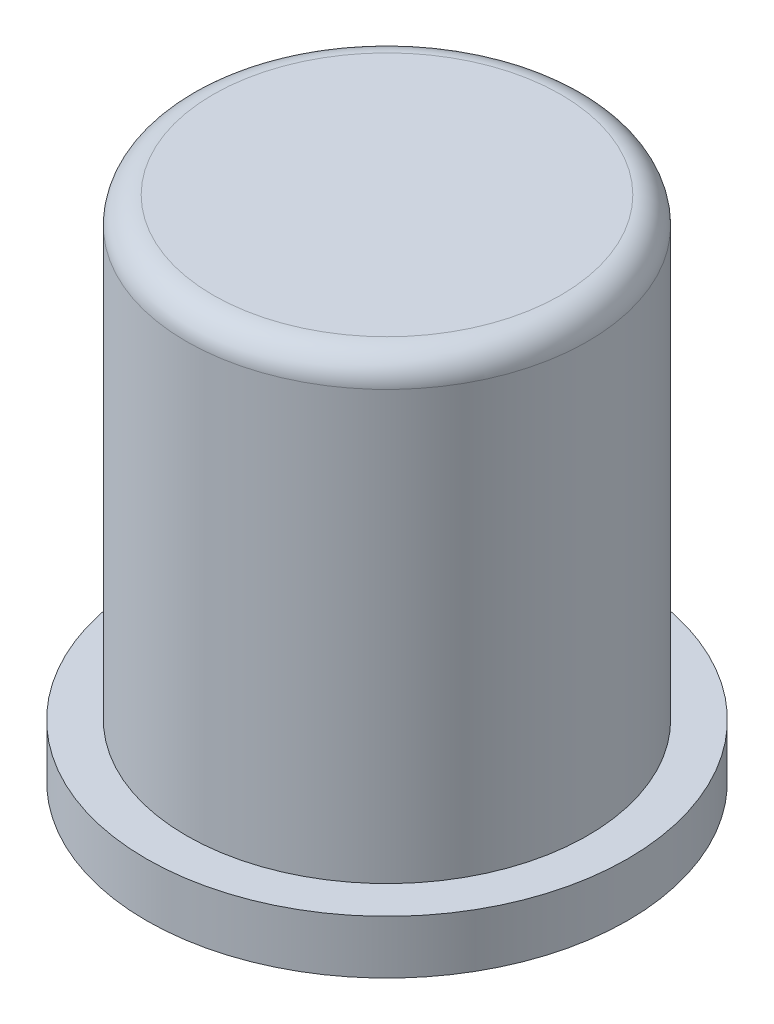
from build123d import *

# Parameters (mm, degrees)
CROQUIS1_R              = 4.5
SALIENTE_EXTRUIR1_DEPTH = 9.5
CORTAR_EXTRUIR1_START   = -8.5
CROQUIS2_R              = 4.5
CROQUIS2_R_2            = 3.75
CORTAR_EXTRUIR1_DEPTH   = 8.5
REDONDEO1_R             = 0.5


with BuildPart() as part:
    # Croquis1 → Saliente-Extruir1 (new body)
    with BuildSketch(Plane(origin=(0, 0, 0), x_dir=(1, 0, 0), z_dir=(0, 1, 0))):
        with Locations(Location((0, 0, 0), (0, 0, 270))):
            Circle(CROQUIS1_R)
    extrude(amount=SALIENTE_EXTRUIR1_DEPTH)

    # Croquis2 → Cortar-Extruir1 (cut)
    with BuildSketch(Plane(origin=(0, 9.5, 0), x_dir=(1, 0, 0), z_dir=(0, 1, 0)).offset(CORTAR_EXTRUIR1_START)):
        with Locations(Location((0, 0, 0), (0, 0, 270))):
            Circle(CROQUIS2_R)
        with Locations(Location((0, 0, 0), (0, 0, 270))):
            Circle(CROQUIS2_R_2, mode=Mode.SUBTRACT)
    extrude(amount=CORTAR_EXTRUIR1_DEPTH, mode=Mode.SUBTRACT)

    # Redondeo1
    redondeo1_edges = [part.edges().sort_by_distance(p)[0] for p in [
        (0, 9.5, -3.75),
    ]]
    fillet(redondeo1_edges, radius=REDONDEO1_R)


solid = part.part
